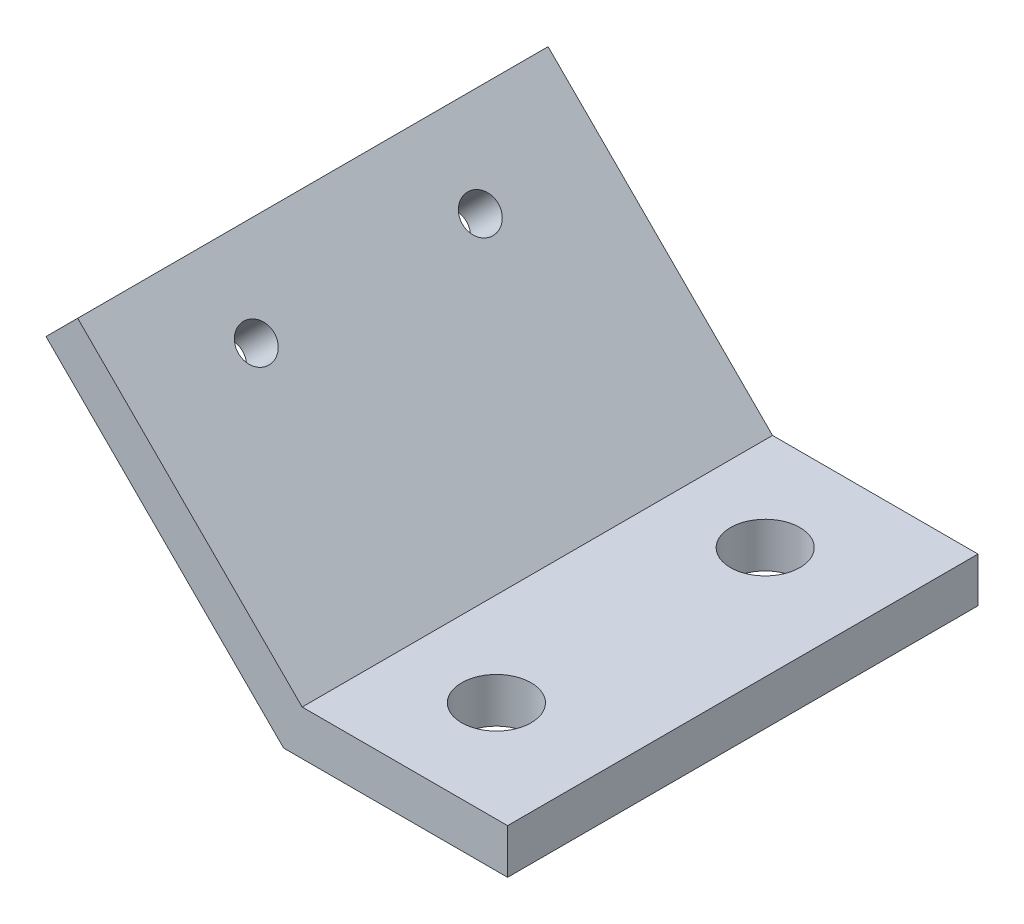
from build123d import *

# Parameters (mm, degrees)
BOSS_EXTRUDE1_DEPTH     = 42
CUT_EXTRUDE1_DEPTH      = 54.409262615
CUT_EXTRUDE1_DEPTH_BACK = 54.409262615
SKETCH4_R               = 1.6
SKETCH5_R               = 3.1
CUT_EXTRUDE2_DEPTH      = 69.909723571


with BuildPart() as part:
    # Sketch1 → Boss-Extrude1 (new body)
    with BuildSketch(Plane.XY):
        Polygon((-26.186542305, -22.524647199), (-7.843396555, -22.524647199), (-7.843396555, -26.524647199), (-27.843396555, -26.524647199), (-49.05659999, -5.311443763), (-46.228172865, -2.483016639), align=None)
    extrude(amount=BOSS_EXTRUDE1_DEPTH)

    # Sketch4 → Cut-Extrude1 (cut, two sides: drawn at the far end of the back side and taken through both)
    with BuildSketch(Plane(origin=(-27.184021877, -27.184021877, 0), x_dir=(0, 0, 1), z_dir=(-0.7071067811865462, -0.707106781186549, 0)).offset(-CUT_EXTRUDE1_DEPTH_BACK)):
        with Locations(Location((31, 23.932496612, 0), (0, 0, 270))):
            Circle(SKETCH4_R)
        with Locations(Location((11, 23.932496612, 0), (0, 0, 270))):
            Circle(SKETCH4_R)
    extrude(amount=CUT_EXTRUDE1_DEPTH + CUT_EXTRUDE1_DEPTH_BACK, mode=Mode.SUBTRACT)

    # Sketch5 → Cut-Extrude2 (cut, through all)
    with BuildSketch(Plane.XZ.offset(26.524647199)):
        with Locations((-17.843396555, 33)):
            Circle(SKETCH5_R)
        with Locations((-17.843396555, 9)):
            Circle(SKETCH5_R)
    extrude(amount=-CUT_EXTRUDE2_DEPTH, mode=Mode.SUBTRACT)


solid = part.part
